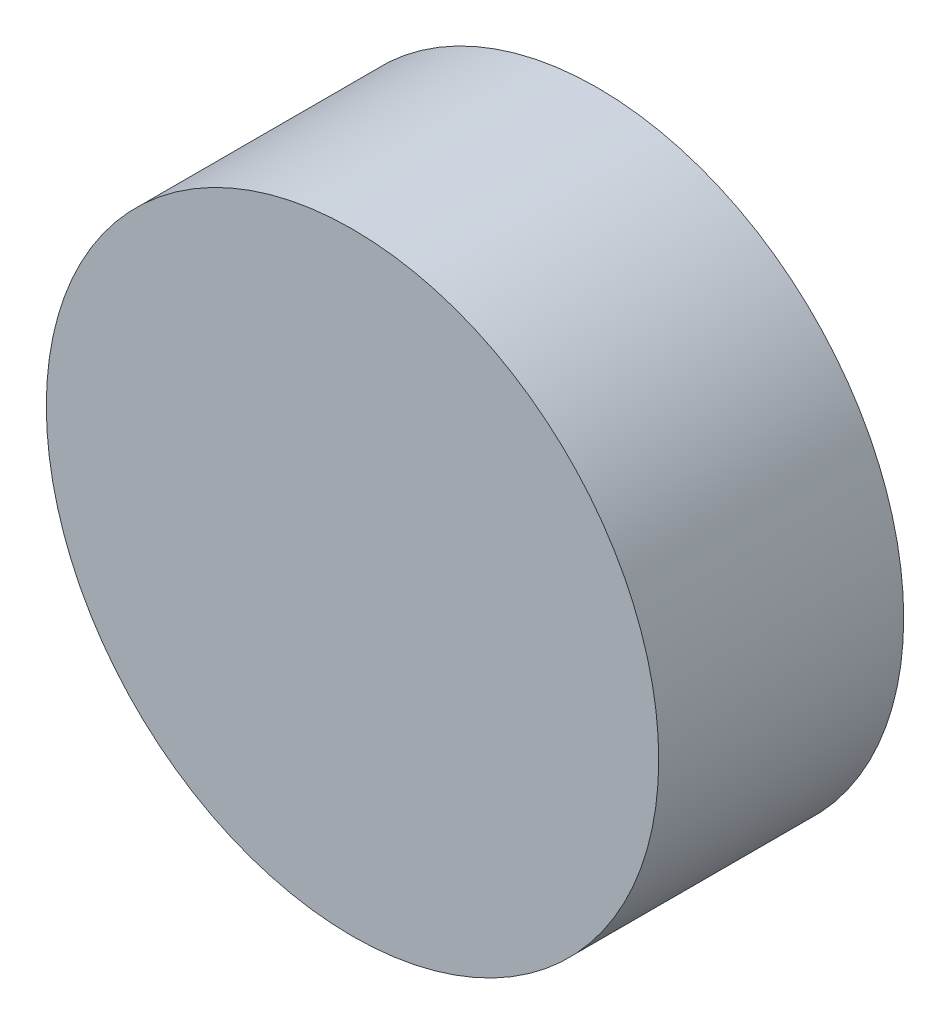
from build123d import *

# Parameters (mm, degrees)
CROQUIS1_R              = 50
SALIENTE_EXTRUIR1_DEPTH = 40
CROQUIS2_R              = 45
CROQUIS2_R_2            = 32.5
CORTAR_EXTRUIR1_DEPTH   = 1.5
CROQUIS3_R              = 13
CROQUIS3_R_2            = 5
CORTAR_EXTRUIR2_DEPTH   = 8
CROQUIS4_R              = 5
CORTAR_EXTRUIR3_DEPTH   = 10


with BuildPart() as part:
    # Croquis1 → Saliente-Extruir1 (new body)
    with BuildSketch(Plane.XY):
        Circle(CROQUIS1_R)
    extrude(amount=SALIENTE_EXTRUIR1_DEPTH)

    # Croquis2 → Cortar-Extruir1 (cut)
    with BuildSketch(Plane(origin=(0, 0, 0), x_dir=(-1, 0, 0), z_dir=(0, 0, -1))):
        Circle(CROQUIS2_R)
        Circle(CROQUIS2_R_2, mode=Mode.SUBTRACT)
    extrude(amount=-CORTAR_EXTRUIR1_DEPTH, mode=Mode.SUBTRACT)

    # Croquis3 → Cortar-Extruir2 (cut)
    with BuildSketch(Plane(origin=(0, 0, 0), x_dir=(-1, 0, 0), z_dir=(0, 0, -1))):
        Circle(CROQUIS3_R)
        Circle(CROQUIS3_R_2, mode=Mode.SUBTRACT)
    extrude(amount=-CORTAR_EXTRUIR2_DEPTH, mode=Mode.SUBTRACT)

    # Croquis4 → Cortar-Extruir3 (cut)
    with BuildSketch(Plane(origin=(0, 0, 0), x_dir=(-1, 0, 0), z_dir=(0, 0, -1))):
        Circle(CROQUIS4_R)
    extrude(amount=-CORTAR_EXTRUIR3_DEPTH, mode=Mode.SUBTRACT)


solid = part.part
